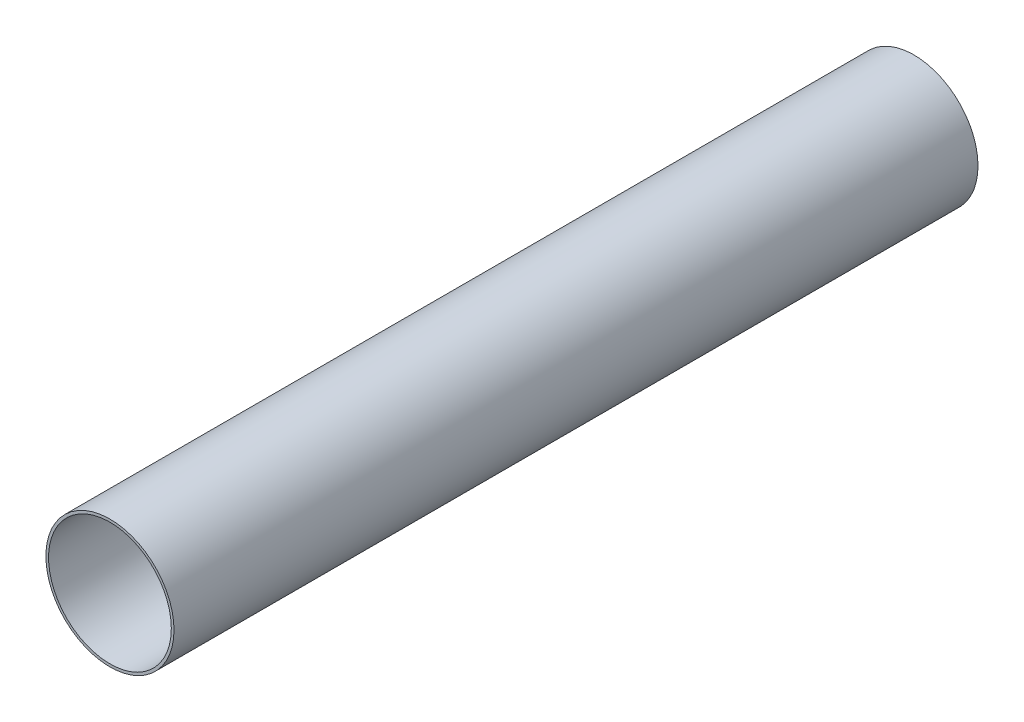
from build123d import *

# Parameters (mm, degrees)
SKETCH1_R        = 55
SKETCH1_R_2      = 52.7
EXTRUSION1_DEPTH = 690.3


with BuildPart() as part:
    # Sketch1 → Extrusion1 (new body)
    with BuildSketch(Plane.XY):
        with Locations((0.140137906, 0)):
            Circle(SKETCH1_R)
        with Locations((0.140137906, 0)):
            Circle(SKETCH1_R_2, mode=Mode.SUBTRACT)
    extrude(amount=EXTRUSION1_DEPTH)


solid = part.part
